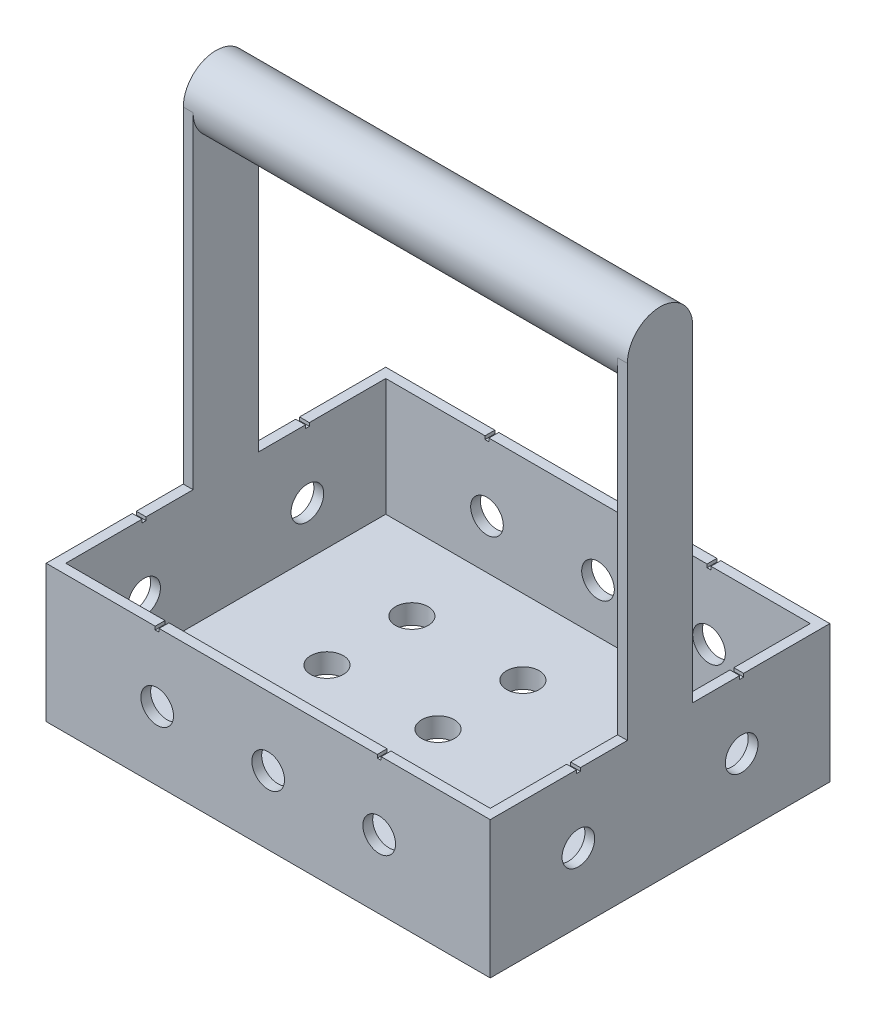
from build123d import *

# Parameters (mm, degrees)
SKETCH_1_W          = 136
SKETCH_1_H          = 104
EXTRUDE_1_DEPTH     = 42
SKETCH_2_W          = 130
SKETCH_2_H          = 98
CUT_EXTRUDE_1_DEPTH = 36
CUT_EXTRUDE_2_REACH = 94.865
SKETCH_3_R          = 5
SKETCH_4_R          = 5
CUT_EXTRUDE_3_DEPTH = 136
SKETCH_5_R          = 5
CUT_EXTRUDE_4_DEPTH = 104
SKETCH_6_W          = 3
SKETCH_6_H          = 20
EXTRUDE_2_DEPTH     = 100
SKETCH_7_R          = 10
EXTRUDE_3_DEPTH     = 130
EXTRUDE_4_DEPTH     = 3
EXTRUDE_START       = -3
EXTRUDE_5_DEPTH     = 3
SKETCH_10_W         = 1.2
SKETCH_10_H         = 2
CUT_EXTRUDE_5_DEPTH = 104
SKETCH_11_W         = 1.2
SKETCH_11_H         = 2
CUT_EXTRUDE_6_DEPTH = 136


with BuildPart() as part:
    # 草图1 → 凸台-拉伸1 (new body)
    with BuildSketch(Plane(origin=(0, 0, 0), x_dir=(1, 0, 0), z_dir=(0, 1, 0))):
        Rectangle(SKETCH_1_W, SKETCH_1_H)
    extrude(amount=EXTRUDE_1_DEPTH)

    # 草图2 → 切除-拉伸1 (cut)
    with BuildSketch(Plane(origin=(0, 42, 0), x_dir=(1, 0, 0), z_dir=(0, 1, 0))):
        Rectangle(SKETCH_2_W, SKETCH_2_H)
    extrude(amount=-CUT_EXTRUDE_1_DEPTH, mode=Mode.SUBTRACT)

    # 草图3 → 切除-拉伸2 (cut, up to next)
    with BuildSketch(Plane(origin=(0, 6, 0), x_dir=(1, 0, 0), z_dir=(0, 1, 0)), mode=Mode.PRIVATE) as cut_extrude_2_sk1:
        with Locations(Location((-34, 26, 0), (0, 0, 270))):
            Circle(SKETCH_3_R)
    cut_extrude_2_tool1 = extrude(cut_extrude_2_sk1.sketch, amount=-CUT_EXTRUDE_2_REACH, mode=Mode.PRIVATE) & part.part
    # 草图3 → 切除-拉伸2 (cut, up to next)
    with BuildSketch(Plane(origin=(0, 6, 0), x_dir=(1, 0, 0), z_dir=(0, 1, 0)), mode=Mode.PRIVATE) as cut_extrude_2_sk2:
        with Locations(Location((-34, -26, 0), (0, 0, 270))):
            Circle(SKETCH_3_R)
    cut_extrude_2_tool2 = extrude(cut_extrude_2_sk2.sketch, amount=-CUT_EXTRUDE_2_REACH, mode=Mode.PRIVATE) & part.part
    # 草图3 → 切除-拉伸2 (cut, up to next)
    with BuildSketch(Plane(origin=(0, 6, 0), x_dir=(1, 0, 0), z_dir=(0, 1, 0)), mode=Mode.PRIVATE) as cut_extrude_2_sk3:
        with Locations(Location((34, 26, 0), (0, 0, 270))):
            Circle(SKETCH_3_R)
    cut_extrude_2_tool3 = extrude(cut_extrude_2_sk3.sketch, amount=-CUT_EXTRUDE_2_REACH, mode=Mode.PRIVATE) & part.part
    # 草图3 → 切除-拉伸2 (cut, up to next)
    with BuildSketch(Plane(origin=(0, 6, 0), x_dir=(1, 0, 0), z_dir=(0, 1, 0)), mode=Mode.PRIVATE) as cut_extrude_2_sk4:
        with Locations(Location((34, -26, 0), (0, 0, 270))):
            Circle(SKETCH_3_R)
    cut_extrude_2_tool4 = extrude(cut_extrude_2_sk4.sketch, amount=-CUT_EXTRUDE_2_REACH, mode=Mode.PRIVATE) & part.part
    # 草图3 → 切除-拉伸2 (cut, up to next)
    with BuildSketch(Plane(origin=(0, 6, 0), x_dir=(1, 0, 0), z_dir=(0, 1, 0)), mode=Mode.PRIVATE) as cut_extrude_2_sk5:
        with Locations(Location((0, 26, 0), (0, 0, 270))):
            Circle(SKETCH_3_R)
    cut_extrude_2_tool5 = extrude(cut_extrude_2_sk5.sketch, amount=-CUT_EXTRUDE_2_REACH, mode=Mode.PRIVATE) & part.part
    # 草图3 → 切除-拉伸2 (cut, up to next)
    with BuildSketch(Plane(origin=(0, 6, 0), x_dir=(1, 0, 0), z_dir=(0, 1, 0)), mode=Mode.PRIVATE) as cut_extrude_2_sk6:
        with Locations(Location((0, 0, 0), (0, 0, 270))):
            Circle(SKETCH_3_R)
    cut_extrude_2_tool6 = extrude(cut_extrude_2_sk6.sketch, amount=-CUT_EXTRUDE_2_REACH, mode=Mode.PRIVATE) & part.part
    # 草图3 → 切除-拉伸2 (cut, up to next)
    with BuildSketch(Plane(origin=(0, 6, 0), x_dir=(1, 0, 0), z_dir=(0, 1, 0)), mode=Mode.PRIVATE) as cut_extrude_2_sk7:
        with Locations(Location((-34, 0, 0), (0, 0, 270))):
            Circle(SKETCH_3_R)
    cut_extrude_2_tool7 = extrude(cut_extrude_2_sk7.sketch, amount=-CUT_EXTRUDE_2_REACH, mode=Mode.PRIVATE) & part.part
    # 草图3 → 切除-拉伸2 (cut, up to next)
    with BuildSketch(Plane(origin=(0, 6, 0), x_dir=(1, 0, 0), z_dir=(0, 1, 0)), mode=Mode.PRIVATE) as cut_extrude_2_sk8:
        with Locations(Location((0, -26, 0), (0, 0, 270))):
            Circle(SKETCH_3_R)
    cut_extrude_2_tool8 = extrude(cut_extrude_2_sk8.sketch, amount=-CUT_EXTRUDE_2_REACH, mode=Mode.PRIVATE) & part.part
    # 草图3 → 切除-拉伸2 (cut, up to next)
    with BuildSketch(Plane(origin=(0, 6, 0), x_dir=(1, 0, 0), z_dir=(0, 1, 0)), mode=Mode.PRIVATE) as cut_extrude_2_sk9:
        with Locations(Location((34, 0, 0), (0, 0, 270))):
            Circle(SKETCH_3_R)
    cut_extrude_2_tool9 = extrude(cut_extrude_2_sk9.sketch, amount=-CUT_EXTRUDE_2_REACH, mode=Mode.PRIVATE) & part.part
    add(cut_extrude_2_tool1.solids().sort_by_distance((-34, 6, -26))[0], mode=Mode.SUBTRACT)
    add(cut_extrude_2_tool2.solids().sort_by_distance((-34, 6, 26))[0], mode=Mode.SUBTRACT)
    add(cut_extrude_2_tool3.solids().sort_by_distance((34, 6, -26))[0], mode=Mode.SUBTRACT)
    add(cut_extrude_2_tool4.solids().sort_by_distance((34, 6, 26))[0], mode=Mode.SUBTRACT)
    add(cut_extrude_2_tool5.solids().sort_by_distance((0, 6, -26))[0], mode=Mode.SUBTRACT)
    add(cut_extrude_2_tool6.solids().sort_by_distance((0, 6, 0))[0], mode=Mode.SUBTRACT)
    add(cut_extrude_2_tool7.solids().sort_by_distance((-34, 6, 0))[0], mode=Mode.SUBTRACT)
    add(cut_extrude_2_tool8.solids().sort_by_distance((0, 6, 26))[0], mode=Mode.SUBTRACT)
    add(cut_extrude_2_tool9.solids().sort_by_distance((34, 6, 0))[0], mode=Mode.SUBTRACT)

    # 草图4 → 切除-拉伸3 (cut)
    with BuildSketch(Plane.ZY.offset(68)):
        with Locations((-25, 21)):
            Circle(SKETCH_4_R)
        with Locations((25, 21)):
            Circle(SKETCH_4_R)
    extrude(amount=-CUT_EXTRUDE_3_DEPTH, mode=Mode.SUBTRACT)

    # 草图5 → 切除-拉伸4 (cut)
    with BuildSketch(Plane.XY.offset(52)):
        with Locations((-34, 21)):
            Circle(SKETCH_5_R)
        with Locations((34, 21)):
            Circle(SKETCH_5_R)
        with Locations((0, 21)):
            Circle(SKETCH_5_R)
    extrude(amount=-CUT_EXTRUDE_4_DEPTH, mode=Mode.SUBTRACT)

    # 草图6 → 凸台-拉伸2 (add)
    with BuildSketch(Plane(origin=(0, 42, 0), x_dir=(1, 0, 0), z_dir=(0, 1, 0))):
        with Locations((-66.5, 0)):
            Rectangle(SKETCH_6_W, SKETCH_6_H)
        with Locations((66.5, 0)):
            Rectangle(SKETCH_6_W, SKETCH_6_H)
    extrude(amount=EXTRUDE_2_DEPTH)

    # 草图7 → 凸台-拉伸3 (add)
    with BuildSketch(Plane(origin=(-65, 0, 0), x_dir=(0, 0, -1), z_dir=(1, 0, 0))):
        with Locations(Location((0, 142, 0), (0, 0, 180))):
            Circle(SKETCH_7_R)
    extrude(amount=EXTRUDE_3_DEPTH)

    # 草图8 → 凸台-拉伸4 (add)
    with BuildSketch(Plane.ZY.offset(68)):
        with BuildLine():
            Line((-10, 142), (10, 142))
            ThreePointArc((10, 142), (0, 152), (-10, 142))
        make_face()
    extrude(amount=-EXTRUDE_4_DEPTH)

    # 草图9 → 凸台-拉伸5 (add)
    with BuildSketch(Plane(origin=(68, 0, 0), x_dir=(0, 0, -1), z_dir=(1, 0, 0)).offset(EXTRUDE_START)):
        with BuildLine():
            Line((-10, 142), (10, 142))
            ThreePointArc((10, 142), (0, 152), (-10, 142))
        make_face()
    extrude(amount=EXTRUDE_5_DEPTH)

    # 草图10 → 切除-拉伸5 (cut)
    with BuildSketch(Plane.XY.offset(52)):
        with Locations((-34, 42)):
            Rectangle(SKETCH_10_W, SKETCH_10_H)
        with Locations((34, 42)):
            Rectangle(SKETCH_10_W, SKETCH_10_H)
    extrude(amount=-CUT_EXTRUDE_5_DEPTH, mode=Mode.SUBTRACT)

    # 草图11 → 切除-拉伸6 (cut)
    with BuildSketch(Plane.ZY.offset(68)):
        with Locations((-25, 42)):
            Rectangle(SKETCH_11_W, SKETCH_11_H)
        with Locations((25, 42)):
            Rectangle(SKETCH_11_W, SKETCH_11_H)
    extrude(amount=-CUT_EXTRUDE_6_DEPTH, mode=Mode.SUBTRACT)


solid = part.part
